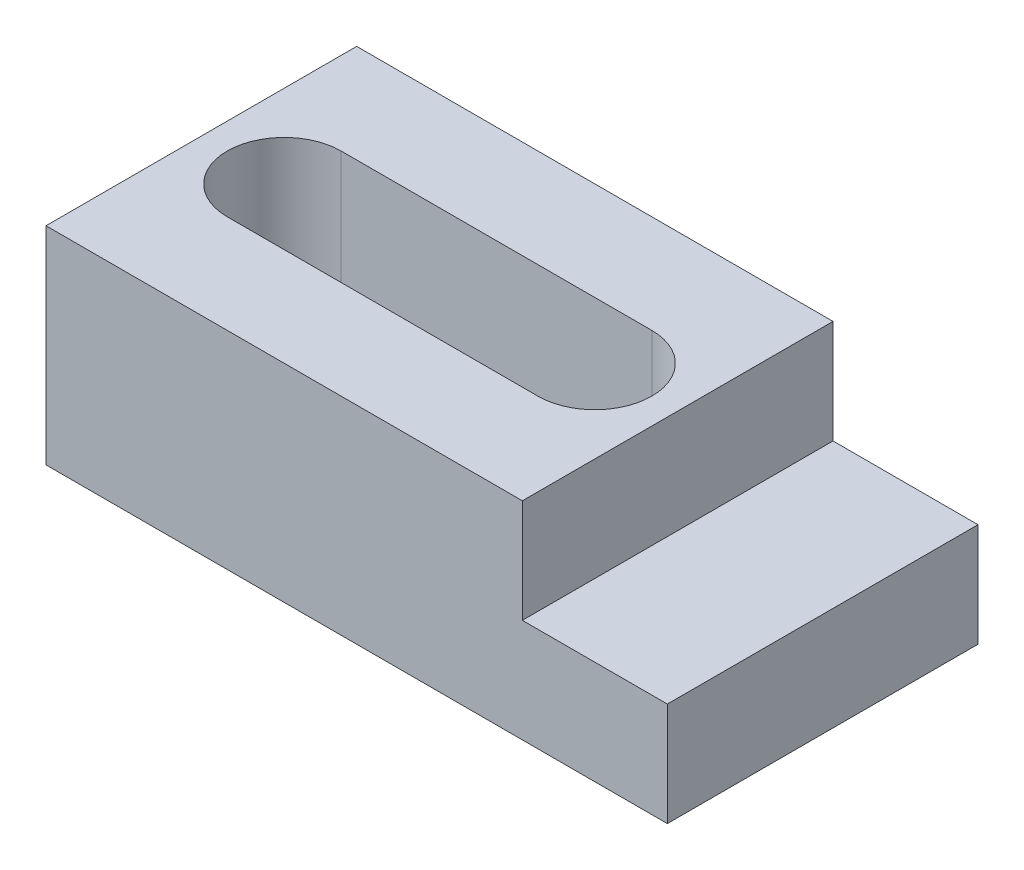
from build123d import *

# Parameters (mm, degrees)
SKETCH1_W               = 30
SKETCH1_H               = 15
BOSS_EXTRUDE1_DEPTH     = 10
CUT_EXTRUDE1_DEPTH      = 24.452078799
CUT_EXTRUDE1_DEPTH_BACK = 24.452078799
SKETCH2_W               = 7
SKETCH2_H               = 5


with BuildPart() as part:
    # Sketch1 → Boss-Extrude1 (new body)
    with BuildSketch(Plane(origin=(0, 0, 0), x_dir=(1, 0, 0), z_dir=(0, 1, 0))):
        Rectangle(SKETCH1_W, SKETCH1_H)
        with BuildLine():
            Line((-11, 2.75), (4, 2.75))
            ThreePointArc((4, 2.75), (6.75, 0), (4, -2.75))
            Line((4, -2.75), (-11, -2.75))
            ThreePointArc((-11, -2.75), (-13.75, 0), (-11, 2.75))
        make_face(mode=Mode.SUBTRACT)
    extrude(amount=BOSS_EXTRUDE1_DEPTH)

    # Sketch2 → Cut-Extrude1 (cut, two sides: drawn at the far end of the back side and taken through both)
    with BuildSketch(Plane.XY.offset(7.5).offset(-CUT_EXTRUDE1_DEPTH_BACK)):
        with Locations((11.5, 7.5)):
            Rectangle(SKETCH2_W, SKETCH2_H)
    extrude(amount=CUT_EXTRUDE1_DEPTH + CUT_EXTRUDE1_DEPTH_BACK, mode=Mode.SUBTRACT)


solid = part.part
